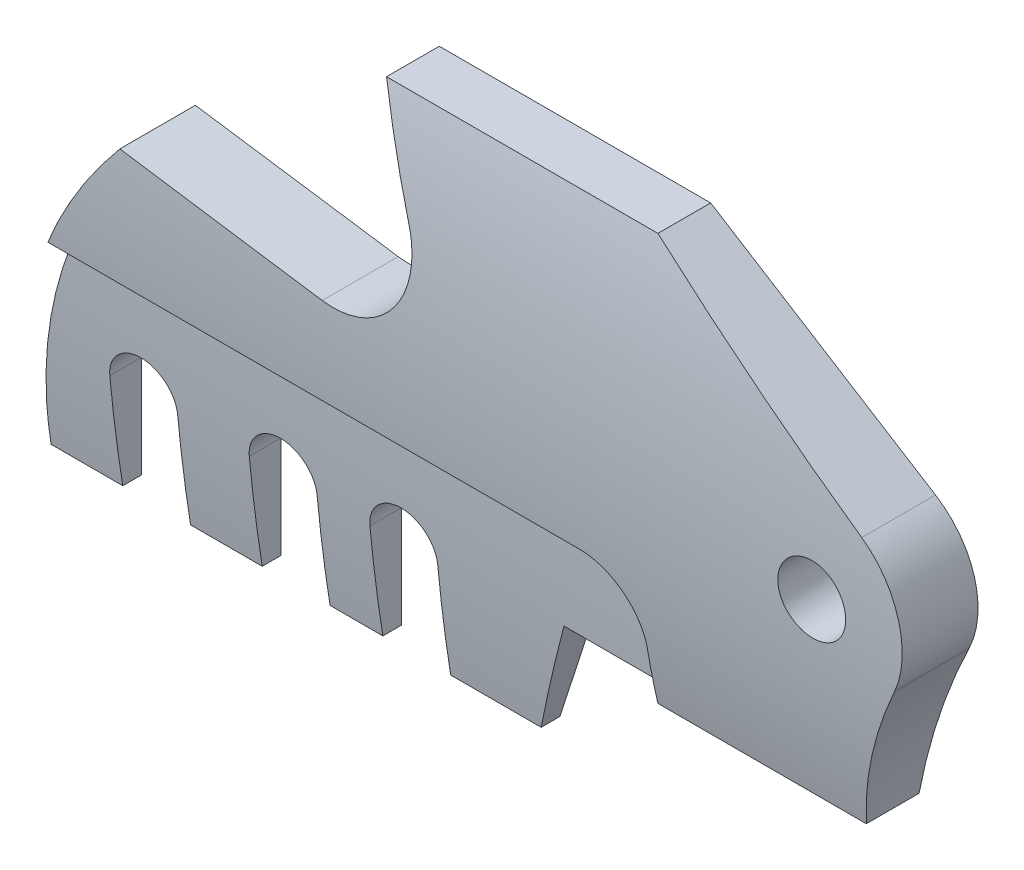
from build123d import *

# Parameters (mm, degrees)
SKETCH_1_R               = 4.5
EXTRUDE_1_DEPTH          = 20
CUT_EXTRUDE_1_DEPTH      = 95.547791144
CUT_EXTRUDE_1_DEPTH_BACK = 95.547791144
SKETCH_2_OUTSIDE_W       = 47.53
SKETCH_2_OUTSIDE_H       = 81.53
SKETCH_2_OUTSIDE_R       = 120
SHELL_1_T                = -2
EXTRUDE_2_DEPTH          = 10
CUT_EXTRUDE_3_DEPTH      = 93.956063424
CUT_EXTRUDE_3_DEPTH_BACK = 93.956063424


with BuildPart() as part:
    # 草图1 → 凸台-拉伸1 (new body)
    with BuildSketch(Plane.XY):
        with BuildLine():
            Line((-15.445099917, 42.104966588), (-42.359878376, 46.03568036))
            ThreePointArc((-42.359878376, 46.03568036), (-47.935865648, 38.351274786), (-52.452272688, 30))
            Line((-52.452272688, 30), (18, 30))
            ThreePointArc((18, 30), (23.656854249, 27.656854249), (26, 22))
            Line((26, 22), (26, 15))
            Line((26, 15), (53.645991862, 15))
            ThreePointArc((53.645991862, 15), (56.296565029, 25.190171372), (60.262459343, 34.94398155))
            ThreePointArc((60.262459343, 34.94398155), (61, 43.503305042), (55.826785402, 50.362155936))
            Line((55.826785402, 50.362155936), (26, 69))
            Line((26, 69), (-10, 69))
            Line((-10, 69), (-4.708099735, 55.696023467))
            ThreePointArc((-4.708099735, 55.696023467), (-6.153199652, 45.800990055), (-15.445099917, 42.104966588))
        make_face()
        with Locations((49.467754231, 40.185578782)):
            Circle(SKETCH_1_R, mode=Mode.SUBTRACT)
    extrude(amount=EXTRUDE_1_DEPTH)

    # 草图2 outside → 切除-拉伸1 (cut, two sides: drawn at the far end of the back side and taken through both)
    with BuildSketch(Plane(origin=(0, 0, 0), x_dir=(0, 0, -1), z_dir=(1, 0, 0)).offset(-CUT_EXTRUDE_1_DEPTH_BACK)):
        with Locations((-10, 42)):
            Rectangle(SKETCH_2_OUTSIDE_W, SKETCH_2_OUTSIDE_H)
        with Locations((109.923051619, 42)):
            Circle(SKETCH_2_OUTSIDE_R, mode=Mode.SUBTRACT)
    extrude(amount=CUT_EXTRUDE_1_DEPTH + CUT_EXTRUDE_1_DEPTH_BACK, mode=Mode.SUBTRACT)

    # 抽壳1
    shell_1_openings = [part.faces().sort_by_distance(p)[0] for p in [
        (15.88368629, 42.212588419, 0),
    ]]
    offset(amount=SHELL_1_T, openings=shell_1_openings)


with BuildPart() as body_2:
    # 草图1<3> → 凸台-拉伸2 (new body)
    with BuildSketch(Plane.XY):
        with BuildLine():
            Line((18, 30), (-52.452272688, 30))
            ThreePointArc((-52.452272688, 30), (-57.344024741, 15.353116402), (-59, 0))
            Line((-59, 0), (-49.5, 0))
            Line((-49.5, 0), (-49.5, 13.5))
            ThreePointArc((-49.5, 13.5), (-45, 18), (-40.5, 13.5))
            Line((-40.5, 13.5), (-40.5, 0))
            Line((-40.5, 0), (-31, 0))
            Line((-31, 0), (-31, 13.5))
            ThreePointArc((-31, 13.5), (-26.5, 18), (-22, 13.5))
            Line((-22, 13.5), (-22, 0))
            Line((-22, 0), (-15, 0))
            Line((-15, 0), (-15, 13.5))
            ThreePointArc((-15, 13.5), (-10.5, 18), (-6, 13.5))
            Line((-6, 13.5), (-6, 0))
            Line((-6, 0), (6, 0))
            Line((6, 0), (10.873795443, 15))
            Line((10.873795443, 15), (26, 15))
            Line((26, 15), (26, 22))
            ThreePointArc((26, 22), (23.656854249, 27.656854249), (18, 30))
        make_face()
    extrude(amount=EXTRUDE_2_DEPTH)

    # 草图3 → 切除-拉伸3 (cut, two sides: drawn at the far end of the back side and taken through both)
    with BuildSketch(Plane(origin=(0, 0, 0), x_dir=(0, 0, -1), z_dir=(1, 0, 0)).offset(-CUT_EXTRUDE_3_DEPTH_BACK)):
        with BuildLine():
            Line((-5.063509484, 180.832397695), (-5.063509484, 32))
            ThreePointArc((-5.063509484, 32), (-4.418319525, 15.948217756), (-2.486912352, 0))
            Line((-2.486912352, 0), (21.326271279, -146.914992049))
            Line((21.326271279, -146.914992049), (-275.378272425, -170.805244435))
            Line((-275.378272425, -170.805244435), (-301.768053188, 156.942145309))
            Line((-301.768053188, 156.942145309), (-5.063509484, 180.832397695))
        make_face()
    extrude(amount=CUT_EXTRUDE_3_DEPTH + CUT_EXTRUDE_3_DEPTH_BACK, mode=Mode.SUBTRACT)


solid = Compound([part.part, body_2.part])
